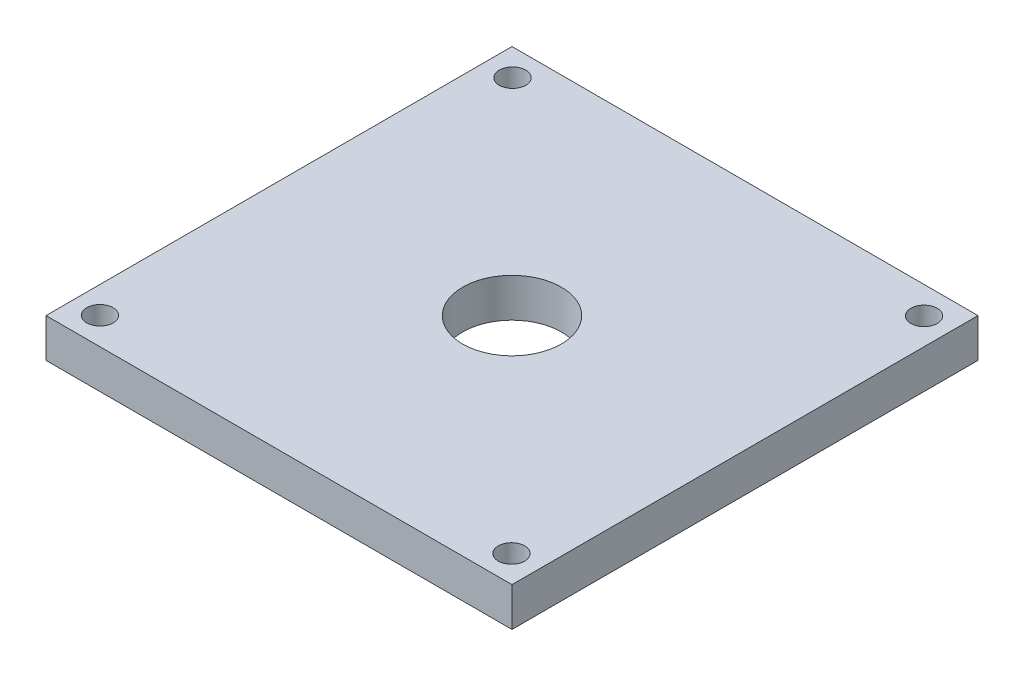
from build123d import *

# Parameters (mm, degrees)
SKETCH_3_W      = 60
SKETCH_3_H      = 60
SKETCH_3_R      = 1.7
SKETCH_3_R_2    = 6.35
EXTRUDE_1_DEPTH = 5


with BuildPart() as part:
    # 草图3 → 凸台-拉伸1 (new body)
    with BuildSketch(Plane(origin=(0, 0, 0), x_dir=(1, 0, 0), z_dir=(0, 1, 0))):
        with Locations((30, 30)):
            Rectangle(SKETCH_3_W, SKETCH_3_H)
        with Locations(Location((3.505302868, 56.560243153, 0), (0, 0, 270))):
            Circle(SKETCH_3_R, mode=Mode.SUBTRACT)
        with Locations(Location((56.560243153, 56.494697132, 0), (0, 0, 270))):
            Circle(SKETCH_3_R, mode=Mode.SUBTRACT)
        with Locations(Location((56.494697132, 3.439756847, 0), (0, 0, 270))):
            Circle(SKETCH_3_R, mode=Mode.SUBTRACT)
        with Locations(Location((3.439756847, 3.505302868, 0), (0, 0, 270))):
            Circle(SKETCH_3_R, mode=Mode.SUBTRACT)
        with Locations(Location((30, 30, 0), (0, 0, 270))):
            Circle(SKETCH_3_R_2, mode=Mode.SUBTRACT)
    extrude(amount=EXTRUDE_1_DEPTH)


solid = part.part
